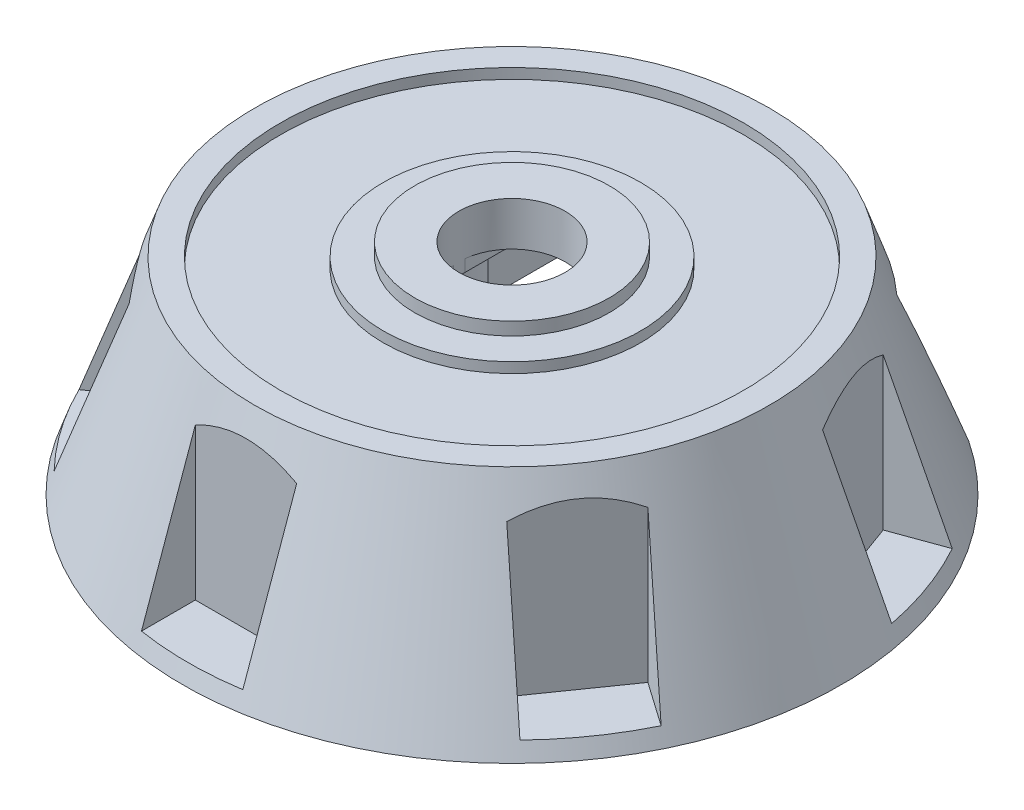
from build123d import *

# Parameters (mm, degrees)
CUT_EXTRUDE1_DEPTH         = 40.2
SKETCH5_R                  = 13.1
CUT_EXTRUDE2_DEPTH         = 10.6
BOSS_EXTRUDE1_START        = 3.175
SKETCH5_3_R                = 24
SKETCH5_3_R_2              = 13.1
BOSS_EXTRUDE1_DEPTH        = 3.175
SKETCH6_W                  = 25
SKETCH6_H                  = 28.783830664
CUT_EXTRUDE3_DEPTH         = 46.8
CIRPATTERN1_COUNT          = 3
CIRPATTERN1_ANGLE          = 110
CIRPATTERN2_COUNT          = 3
CIRPATTERN2_ANGLE          = 110
SKETCH7_W                  = 26.05355805
SKETCH7_H                  = 46.414815382
CUT_EXTRUDE4_DEPTH         = 2.95
M2_5_CLEARANCE_HOLE1_D     = 2.9
M2_5_CLEARANCE_HOLE1_DEPTH = 6
M2_5_CLEARANCE_HOLE1_TIP   = 0.871247898
SKETCH11_R                 = 57.15
SKETCH11_R_2               = 31.75
CUT_EXTRUDE5_DEPTH         = 2.54


with BuildPart() as part:
    # Sketch3 → Revolve1 (revolve)
    with BuildSketch(Plane.XY, mode=Mode.PRIVATE) as revolve1_sk:
        Polygon((60.96, 0), (81.28, 0), (63.5, 50.8), (0, 50.8), (0, 0), align=None)
    revolve(revolve1_sk.sketch.rotate(Axis((0, 0, 0), (0, 1, 0)), 90), axis=Axis((0, 0, 0), (0, 1, 0)))

    # Sketch4 → Cut-Extrude1 (cut)
    with BuildSketch(Plane(origin=(0, 0, 0), x_dir=(-1, 0, 0), z_dir=(0, -1, 0))):
        with BuildLine():
            Line((-44.999992712, 39.078902952), (-44.999992712, 81.540670454))
            Line((-44.999992712, 81.540670454), (44.999992712, 81.540670454))
            Line((44.999992712, 81.540670454), (44.999992712, 39.078902952))
            ThreePointArc((44.999992712, 39.078902952), (0, -59.6), (-44.999992712, 39.078902952))
        make_face()
    extrude(amount=-CUT_EXTRUDE1_DEPTH, mode=Mode.SUBTRACT)

    # Sketch5 → Cut-Extrude2 (cut)
    with BuildSketch(Plane(origin=(0, 50.8, 0), x_dir=(1, 0, 0), z_dir=(0, 1, 0))):
        with Locations(Location((0, 0, 0), (0, 0, 270))):
            Circle(SKETCH5_R)
    extrude(amount=-CUT_EXTRUDE2_DEPTH, mode=Mode.SUBTRACT)

    # Sketch5<3> → Boss-Extrude1 (add)
    with BuildSketch(Plane(origin=(0, 50.8, 0), x_dir=(1, 0, 0), z_dir=(0, 1, 0)).offset(BOSS_EXTRUDE1_START)):
        with Locations(Location((0, 0, 0), (0, 0, 270))):
            Circle(SKETCH5_3_R)
        with Locations(Location((0, 0, 0), (0, 0, 270))):
            Circle(SKETCH5_3_R_2, mode=Mode.SUBTRACT)
    extrude(amount=-BOSS_EXTRUDE1_DEPTH)

    # Sketch6 → Cut-Extrude3 (cut)
    with BuildSketch(Plane(origin=(0, 50.8, 0), x_dir=(1, 0, 0), z_dir=(0, 1, 0))):
        with Locations((0, -80)):
            Rectangle(SKETCH6_W, SKETCH6_H)
    cut_extrude3 = extrude(amount=-CUT_EXTRUDE3_DEPTH, mode=Mode.SUBTRACT)

    # CirPattern1: Cut-Extrude3 ×3 about axis
    cirpattern1_axis = Axis((0, 0, 0), (0, -1, 0))
    for i in range(1, CIRPATTERN1_COUNT):
        add(cut_extrude3.rotate(cirpattern1_axis, i * CIRPATTERN1_ANGLE / (CIRPATTERN1_COUNT - 1)), mode=Mode.SUBTRACT)

    # CirPattern2: Cut-Extrude3 ×3 about axis
    cirpattern2_axis = Axis((0, 0, 0), (0, 1, 0))
    for i in range(1, CIRPATTERN2_COUNT):
        add(cut_extrude3.rotate(cirpattern2_axis, i * CIRPATTERN2_ANGLE / (CIRPATTERN2_COUNT - 1)), mode=Mode.SUBTRACT)

    # Sketch7 → Cut-Extrude4 (cut)
    with BuildSketch(Plane.XZ.offset(-40.2)):
        with Locations((0, -4.57891024)):
            Rectangle(SKETCH7_W, SKETCH7_H)
    extrude(amount=-CUT_EXTRUDE4_DEPTH, mode=Mode.SUBTRACT)

    # M2.5 Clearance Hole1
    with Locations(Plane(origin=(0, 40.2, 0), x_dir=(-1, 0, 0), z_dir=(0, -1, 0))):
        with Locations((-15, -4.5), (15, -4.5), (15, 12.5), (-15, 12.5), (15, 29.5), (-15, 29.5), (-8.5, 35.8), (8.5, 35.8)):
            Hole(M2_5_CLEARANCE_HOLE1_D / 2, depth=M2_5_CLEARANCE_HOLE1_DEPTH)
            with Locations((0, 0, -(M2_5_CLEARANCE_HOLE1_DEPTH + M2_5_CLEARANCE_HOLE1_TIP / 2))):  # 118° drill point
                Cone(0, M2_5_CLEARANCE_HOLE1_D / 2, M2_5_CLEARANCE_HOLE1_TIP, mode=Mode.SUBTRACT)

    # Sketch11 → Cut-Extrude5 (cut)
    with BuildSketch(Plane(origin=(0, 50.8, 0), x_dir=(1, 0, 0), z_dir=(0, 1, 0))):
        with Locations(Location((0, 0, 0), (0, 0, 270))):
            Circle(SKETCH11_R)
        with Locations(Location((0, 0, 0), (0, 0, 270))):
            Circle(SKETCH11_R_2, mode=Mode.SUBTRACT)
    extrude(amount=-CUT_EXTRUDE5_DEPTH, mode=Mode.SUBTRACT)


solid = part.part
